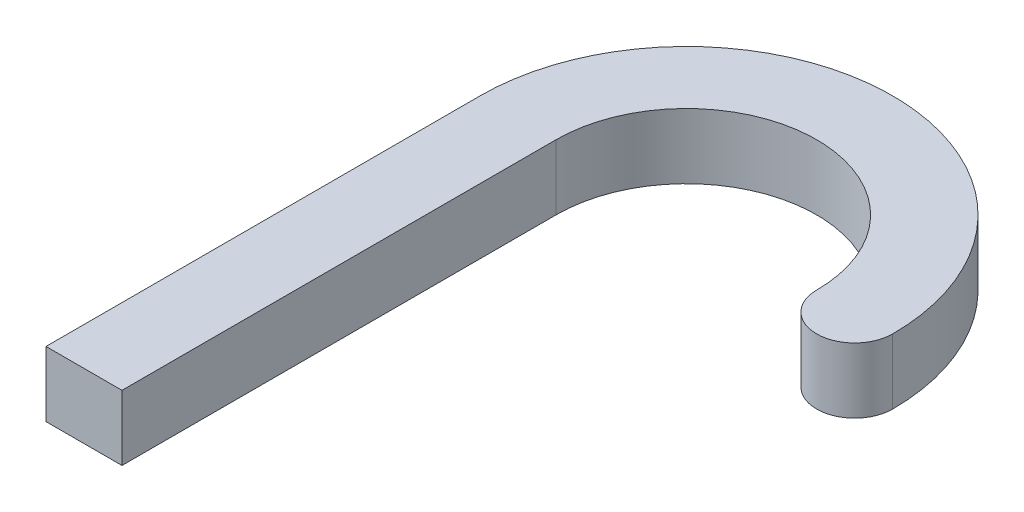
from build123d import *

# Parameters (mm, degrees)
BOSS_EXTRUDE1_DEPTH = 3


with BuildPart() as part:
    # Sketch1 → Boss-Extrude1 (new body)
    with BuildSketch(Plane(origin=(0, 0, 0), x_dir=(1, 0, 0), z_dir=(0, 1, 0))):
        with BuildLine():
            Line((0, 0), (3.5, 0))
            Line((3.5, 0), (3.5, 20))
            ThreePointArc((3.5, 20), (9.5, 26), (15.5, 20))
            ThreePointArc((15.5, 20), (17.25, 18.25), (19, 20))
            ThreePointArc((19, 20), (9.5, 29.5), (0, 20))
            Line((0, 20), (0, 0))
        make_face()
    extrude(amount=BOSS_EXTRUDE1_DEPTH)


solid = part.part
